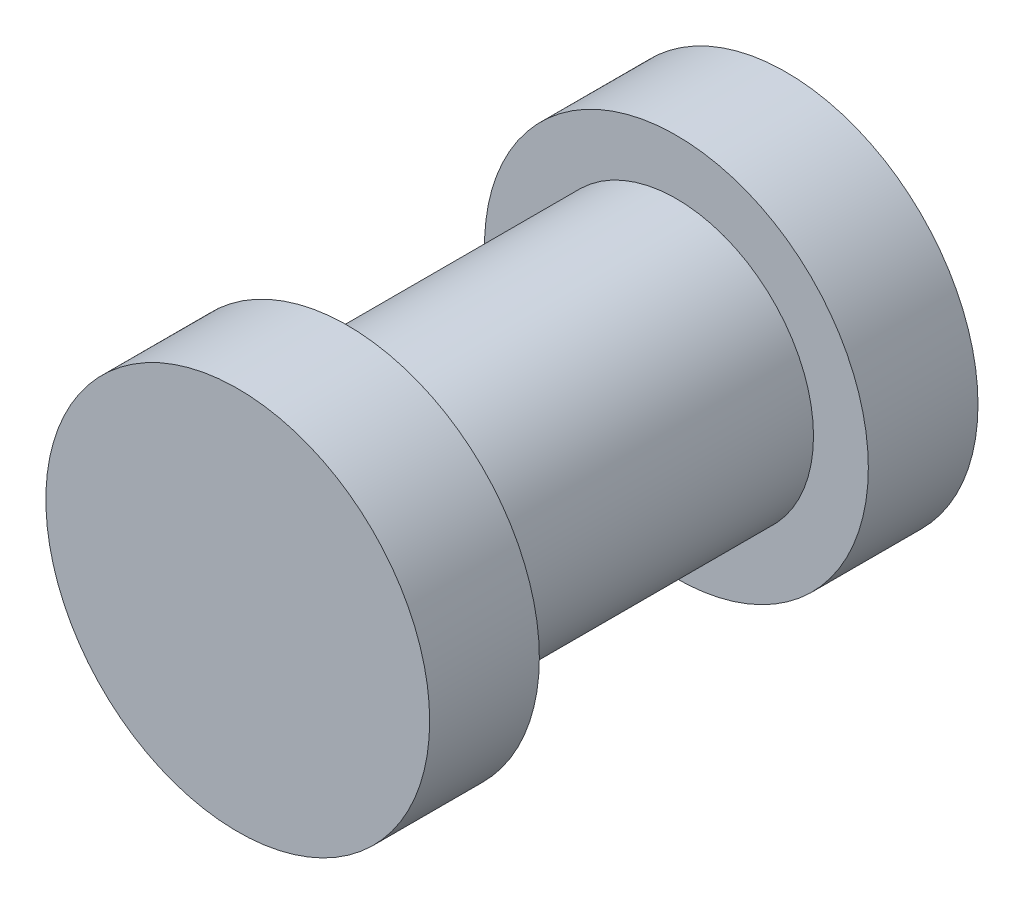
from build123d import *

# Parameters (mm, degrees)
SKETCH1_R               = 3.5
BOSS_EXTRUDE1_DEPTH     = 10
CUT_EXTRUDE1_DEPTH      = 3
CUT_EXTRUDE1_DEPTH_BACK = 3
CUT_EXTRUDE1_START      = -5
SKETCH2_R               = 3.5
SKETCH2_R_2             = 2.5


with BuildPart() as part:
    # Sketch1 → Boss-Extrude1 (new body)
    with BuildSketch(Plane.XY):
        Circle(SKETCH1_R)
    extrude(amount=BOSS_EXTRUDE1_DEPTH)

    # Sketch2 → Cut-Extrude1 (cut, two sides: drawn at the far end of the back side and taken through both)
    with BuildSketch(Plane.XY.offset(10).offset(CUT_EXTRUDE1_START - CUT_EXTRUDE1_DEPTH_BACK)):
        Circle(SKETCH2_R)
        Circle(SKETCH2_R_2, mode=Mode.SUBTRACT)
    extrude(amount=CUT_EXTRUDE1_DEPTH + CUT_EXTRUDE1_DEPTH_BACK, mode=Mode.SUBTRACT)


solid = part.part
